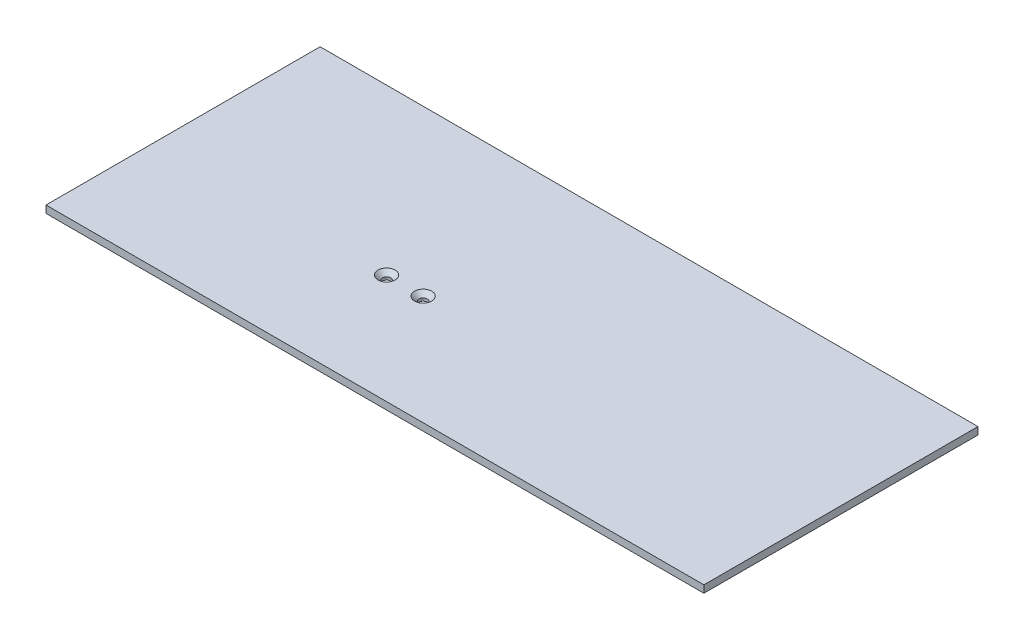
from build123d import *

# Parameters (mm, degrees)
BOSS_EXTRUDE1_DEPTH                          = 4
CSK_FOR_M4_COUNTERSUNK_FLAT_HEAD_SCR_2_COUNT = 2
CSK_FOR_M4_COUNTERSUNK_FLAT_HEAD_SCR_2_PITCH = 20


with BuildPart() as part:
    # Sketch1 → Boss-Extrude1 (new body)
    with BuildSketch(Plane(origin=(0, 0, 0), x_dir=(1, 0, 0), z_dir=(0, 1, 0))):
        Polygon((-180, -45), (180, -45), (180, 45), (180, 105), (-180, 105), (-180, 45), align=None)
    extrude(amount=BOSS_EXTRUDE1_DEPTH)

    # Sketch4 → CSK for M4 Countersunk Flat Head Screw1 (revolve, cut)
    with BuildSketch(Plane(origin=(-53.634798041, 4, -15), x_dir=(0, 0, 1), z_dir=(1, 0, 0))):
        Polygon((0, 0), (0, 4), (2.25, 4), (2.25, 2.45), (4.7, 0), align=None)
    csk_for_m4_countersunk_flat_head_screw1 = revolve(axis=Axis((-53.634798041, 10.35, -15), (0, -1, 0)), mode=Mode.SUBTRACT)

    # CSK for M4 Countersunk Flat Head Scr 2: CSK for M4 Countersunk Flat Head Screw1 ×2
    with Locations(*[(i * CSK_FOR_M4_COUNTERSUNK_FLAT_HEAD_SCR_2_PITCH, 0, 0) for i in range(1, CSK_FOR_M4_COUNTERSUNK_FLAT_HEAD_SCR_2_COUNT)]):
        add(csk_for_m4_countersunk_flat_head_screw1, mode=Mode.SUBTRACT)


solid = part.part
